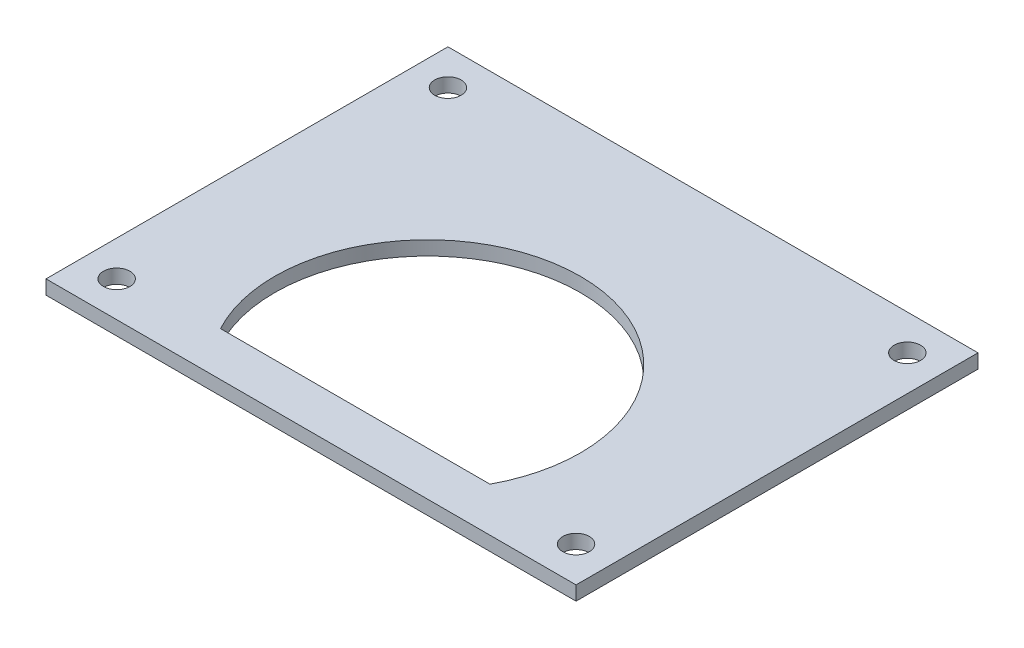
from build123d import *

# Parameters (mm, degrees)
SKETCH1_W           = 60
SKETCH1_H           = 45.5
SKETCH1_R           = 1.5
BOSS_EXTRUDE3_DEPTH = 1.6


with BuildPart() as part:
    # Sketch1 → Boss-Extrude3 (new body)
    with BuildSketch(Plane(origin=(0, 0, 0), x_dir=(1, 0, 0), z_dir=(0, 1, 0))):
        with Locations((0, 9.56004902)):
            Rectangle(SKETCH1_W, SKETCH1_H)
        with Locations(Location((-26, 28.31004902, 0), (0, 0, 270))):
            Circle(SKETCH1_R, mode=Mode.SUBTRACT)
        with Locations(Location((26, 28.31004902, 0), (0, 0, 270))):
            Circle(SKETCH1_R, mode=Mode.SUBTRACT)
        with Locations(Location((-26, -9.18995098, 0), (0, 0, 270))):
            Circle(SKETCH1_R, mode=Mode.SUBTRACT)
        with Locations(Location((26, -9.18995098, 0), (0, 0, 270))):
            Circle(SKETCH1_R, mode=Mode.SUBTRACT)
        with BuildLine():
            Line((-15.25, -8.18995098), (15.25, -8.18995098))
            ThreePointArc((15.25, -8.18995098), (0, 17.31004902), (-15.25, -8.18995098))
        make_face(mode=Mode.SUBTRACT)
    extrude(amount=BOSS_EXTRUDE3_DEPTH)


solid = part.part
